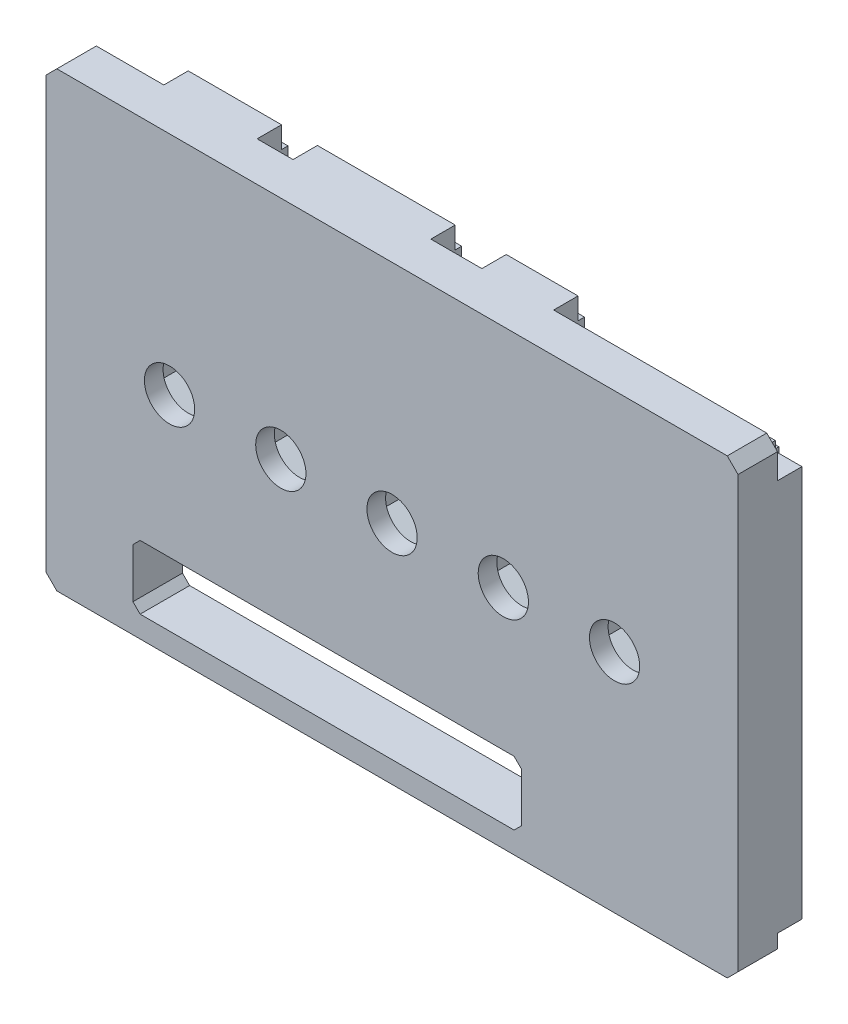
from build123d import *

# Parameters (mm, degrees)
SKETCH1_W            = 96.4
SKETCH1_H            = 63
BOSS_EXTRUDE1_DEPTH  = 5.5
SKETCH1_5_W          = 93
SKETCH1_5_H          = 59.6
BOSS_EXTRUDE2_DEPTH  = 1.4
CHAMFER1_SIZE        = 1.5
SKETCH3_W            = 1.7
SKETCH3_H            = 13.2
BOSS_EXTRUDE4_DEPTH  = 1.7
SKETCH4_W            = 13
SKETCH4_H            = 1.7
SKETCH4_W_2          = 10
SKETCH4_W_3          = 19.2
BOSS_EXTRUDE5_DEPTH  = 1.6
SKETCH4_3_W          = 13
SKETCH4_3_H          = 3
SKETCH4_3_W_2        = 10
SKETCH4_3_W_3        = 19.2
BOSS_EXTRUDE6_DEPTH  = 2
SKETCH3_5_W          = 3
SKETCH3_5_H          = 13.2
BOSS_EXTRUDE7_DEPTH  = 1
SKETCH5_W            = 1.7
SKETCH5_H            = 54.6
BOSS_EXTRUDE8_DEPTH  = 1.6
SKETCH5_3_W          = 3
SKETCH5_3_H          = 54.6
BOSS_EXTRUDE9_DEPTH  = 2
SKETCH7_W            = 54.1
SKETCH7_H            = 8.9
CUT_EXTRUDE2_DEPTH   = 12
CHAMFER2_SIZE        = 1
SKETCH11_W           = 10
SKETCH11_H           = 2
SKETCH11_W_2         = 19.2
SKETCH11_W_3         = 13
BOSS_EXTRUDE10_DEPTH = 2
SKETCH13_W           = 10
SKETCH13_H           = 2
SKETCH13_W_2         = 19.2
SKETCH13_W_3         = 13
BOSS_EXTRUDE12_DEPTH = 0.9
SKETCH14_W           = 54.1
SKETCH14_H           = 3
BOSS_EXTRUDE13_DEPTH = 2.9
SKETCH15_W           = 2
SKETCH15_H           = 54.6
BOSS_EXTRUDE14_DEPTH = 4.5
SKETCH16_W           = 3.5
SKETCH16_H           = 54.6
BOSS_EXTRUDE15_DEPTH = 0.8
SKETCH18_R           = 3.5
CUT_EXTRUDE4_DEPTH   = 12
CUT_EXTRUDE5_DEPTH   = 4.3


with BuildPart() as part:
    # Sketch1 → Boss-Extrude1 (new body)
    with BuildSketch(Plane.XY):
        with Locations((10.058192988, -1.431154761)):
            Rectangle(SKETCH1_W, SKETCH1_H)
    extrude(amount=BOSS_EXTRUDE1_DEPTH)

    # Sketch1<5> → Boss-Extrude2 (add)
    with BuildSketch(Plane.XY):
        with Locations((10.058192988, -1.431154761)):
            Rectangle(SKETCH1_5_W, SKETCH1_5_H)
    extrude(amount=-BOSS_EXTRUDE2_DEPTH)

    # Chamfer1
    chamfer1_edges = [part.edges().sort_by_distance(p)[0] for p in [
        (58.258192988, 30.068845239, 2.75),
        (-38.141807012, 30.068845239, 2.75),
        (-38.141807012, -32.931154761, 2.75),
        (58.258192988, -32.931154761, 2.75),
    ]]
    chamfer(chamfer1_edges, length=CHAMFER1_SIZE)

    # Sketch3 → Boss-Extrude4 (add)
    with BuildSketch(Plane(origin=(0, 0, -1.4), x_dir=(-1, 0, 0), z_dir=(0, 0, -1))):
        with Locations((37.291807012, -1.631154761)):
            Rectangle(SKETCH3_W, SKETCH3_H)
    extrude(amount=-BOSS_EXTRUDE4_DEPTH)

    # Sketch4 → Boss-Extrude5 (add)
    with BuildSketch(Plane(origin=(0, 0, -1.4), x_dir=(-1, 0, 0), z_dir=(0, 0, -1))):
        with Locations((20.741807012, 29.218845239)):
            Rectangle(SKETCH4_W, SKETCH4_H)
        with Locations((-22.068192988, 29.218845239)):
            Rectangle(SKETCH4_W_2, SKETCH4_H)
        with Locations((-0.358192988, 29.218845239)):
            Rectangle(SKETCH4_W_3, SKETCH4_H)
    extrude(amount=-BOSS_EXTRUDE5_DEPTH)

    # Sketch4<3> → Boss-Extrude6 (add)
    with BuildSketch(Plane(origin=(0, 0, -1.4), x_dir=(-1, 0, 0), z_dir=(0, 0, -1))):
        with Locations((20.741807012, 28.568845239)):
            Rectangle(SKETCH4_3_W, SKETCH4_3_H)
        with Locations((-22.068192988, 28.568845239)):
            Rectangle(SKETCH4_3_W_2, SKETCH4_3_H)
        with Locations((-0.358192988, 28.568845239)):
            Rectangle(SKETCH4_3_W_3, SKETCH4_3_H)
    extrude(amount=BOSS_EXTRUDE6_DEPTH)

    # Sketch3<5> → Boss-Extrude7 (add)
    with BuildSketch(Plane(origin=(0, 0, -1.4), x_dir=(-1, 0, 0), z_dir=(0, 0, -1))):
        with Locations((36.641807012, -1.631154761)):
            Rectangle(SKETCH3_5_W, SKETCH3_5_H)
    extrude(amount=BOSS_EXTRUDE7_DEPTH)

    # Sketch5 → Boss-Extrude8 (add)
    with BuildSketch(Plane(origin=(0, 0, -1.4), x_dir=(-1, 0, 0), z_dir=(0, 0, -1))):
        with Locations((-57.408192988, -2.231154761)):
            Rectangle(SKETCH5_W, SKETCH5_H)
    extrude(amount=-BOSS_EXTRUDE8_DEPTH)

    # Sketch5<3> → Boss-Extrude9 (add)
    with BuildSketch(Plane(origin=(0, 0, -1.4), x_dir=(-1, 0, 0), z_dir=(0, 0, -1))):
        with Locations((-56.758192988, -2.231154761)):
            Rectangle(SKETCH5_3_W, SKETCH5_3_H)
    extrude(amount=BOSS_EXTRUDE9_DEPTH)

    # Sketch7 → Cut-Extrude2 (cut)
    with BuildSketch(Plane.XY.offset(5.5)):
        with Locations((1.008192988, -25.481154761)):
            Rectangle(SKETCH7_W, SKETCH7_H)
    extrude(amount=-CUT_EXTRUDE2_DEPTH, mode=Mode.SUBTRACT)

    # Chamfer2
    chamfer2_edges = [part.edges().sort_by_distance(p)[0] for p in [
        (28.058192988, -21.031154761, 2.05),
        (28.058192988, -29.931154761, 2.05),
        (-26.041807012, -29.931154761, 2.05),
        (-26.041807012, -21.031154761, 2.05),
    ]]
    chamfer(chamfer2_edges, length=CHAMFER2_SIZE)

    # Sketch11 → Boss-Extrude10 (add)
    with BuildSketch(Plane.XZ.offset(-27.068845239)):
        with Locations((22.068192988, -2.4)):
            Rectangle(SKETCH11_W, SKETCH11_H)
        with Locations((0.358192988, -2.4)):
            Rectangle(SKETCH11_W_2, SKETCH11_H)
        with Locations((-20.741807012, -2.4)):
            Rectangle(SKETCH11_W_3, SKETCH11_H)
    extrude(amount=BOSS_EXTRUDE10_DEPTH)

    # Sketch13 → Boss-Extrude12 (add)
    with BuildSketch(Plane(origin=(0, 0, -3.4), x_dir=(-1, 0, 0), z_dir=(0, 0, -1))):
        with Locations((-22.068192988, 26.068845239)):
            Rectangle(SKETCH13_W, SKETCH13_H)
        with Locations((-0.358192988, 26.068845239)):
            Rectangle(SKETCH13_W_2, SKETCH13_H)
        with Locations((20.741807012, 26.068845239)):
            Rectangle(SKETCH13_W_3, SKETCH13_H)
    extrude(amount=BOSS_EXTRUDE12_DEPTH)

    # Sketch14 → Boss-Extrude13 (add)
    with BuildSketch(Plane(origin=(0, 0, -1.4), x_dir=(-1, 0, 0), z_dir=(0, 0, -1))):
        with Locations((-1.008192988, -19.531154761)):
            Rectangle(SKETCH14_W, SKETCH14_H)
    extrude(amount=BOSS_EXTRUDE13_DEPTH)

    # Sketch15 → Boss-Extrude14 (add)
    with BuildSketch(Plane.ZY.offset(-55.258192988)):
        with Locations((-2.4, -2.231154761)):
            Rectangle(SKETCH15_W, SKETCH15_H)
    extrude(amount=BOSS_EXTRUDE14_DEPTH)

    # Sketch16 → Boss-Extrude15 (add)
    with BuildSketch(Plane(origin=(0, 0, -3.4), x_dir=(-1, 0, 0), z_dir=(0, 0, -1))):
        with Locations((-52.508192988, -2.231154761)):
            Rectangle(SKETCH16_W, SKETCH16_H)
    extrude(amount=BOSS_EXTRUDE15_DEPTH)

    # Sketch18 → Cut-Extrude4 (cut)
    with BuildSketch(Plane(origin=(0, 0, -1.4), x_dir=(-1, 0, 0), z_dir=(0, 0, -1))):
        with Locations((-41.058192988, -1.431154761)):
            Circle(SKETCH18_R)
        with Locations((-25.558192988, -1.431154761)):
            Circle(SKETCH18_R)
        with Locations((-10.058192988, -1.431154761)):
            Circle(SKETCH18_R)
        with Locations((5.441807012, -1.431154761)):
            Circle(SKETCH18_R)
        with Locations((20.941807012, -1.431154761)):
            Circle(SKETCH18_R)
    extrude(amount=-CUT_EXTRUDE4_DEPTH, mode=Mode.SUBTRACT)

    # Sketch18<3> → Cut-Extrude5 (cut)
    with BuildSketch(Plane(origin=(0, 0, -1.4), x_dir=(-1, 0, 0), z_dir=(0, 0, -1))):
        Polygon((-41.058192988, -8.070682857), (-35.308192988, -4.750918809), (-35.308192988, 1.888609286), (-41.058192988, 5.319984429), (-46.808192988, 1.888609286), (-46.808192988, -4.750918809), align=None)
        Polygon((-25.558192988, 5.208373334), (-31.308192988, 1.888609286), (-31.308192988, -4.750918809), (-25.558192988, -8.070682857), (-19.808192988, -4.750918809), (-19.808192988, 1.888609286), align=None)
        Polygon((-10.058192988, 5.208373334), (-15.808192988, 1.888609286), (-15.808192988, -4.750918809), (-10.058192988, -8.070682857), (-4.308192988, -4.750918809), (-4.308192988, 1.888609286), align=None)
        Polygon((5.441807012, 5.208373334), (-0.308192988, 1.888609286), (-0.308192988, -4.750918809), (5.441807012, -8.070682857), (11.191807012, -4.750918809), (11.191807012, 1.888609286), align=None)
        Polygon((20.941807012, 5.208373334), (15.191807012, 1.888609286), (15.191807012, -4.750918809), (20.941807012, -8.070682857), (26.691807012, -4.750918809), (26.691807012, 1.888609286), align=None)
    extrude(amount=-CUT_EXTRUDE5_DEPTH, mode=Mode.SUBTRACT)


solid = part.part
